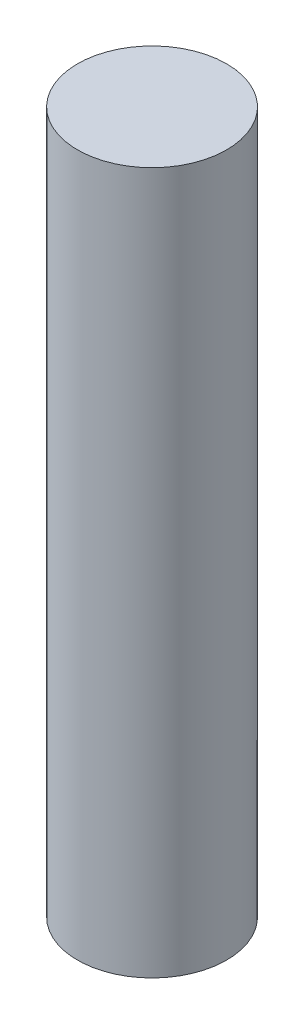
from build123d import *

# Parameters (mm, degrees)
SKETCH1_R           = 2.54
BOSS_EXTRUDE1_DEPTH = 23.9


with BuildPart() as part:
    # Sketch1 → Boss-Extrude1 (new body)
    with BuildSketch(Plane(origin=(0, 0, 0), x_dir=(1, 0, 0), z_dir=(0, 1, 0))):
        with Locations(Location((0, 0, 0), (0, 0, 90))):
            Circle(SKETCH1_R)
    extrude(amount=BOSS_EXTRUDE1_DEPTH)


solid = part.part
